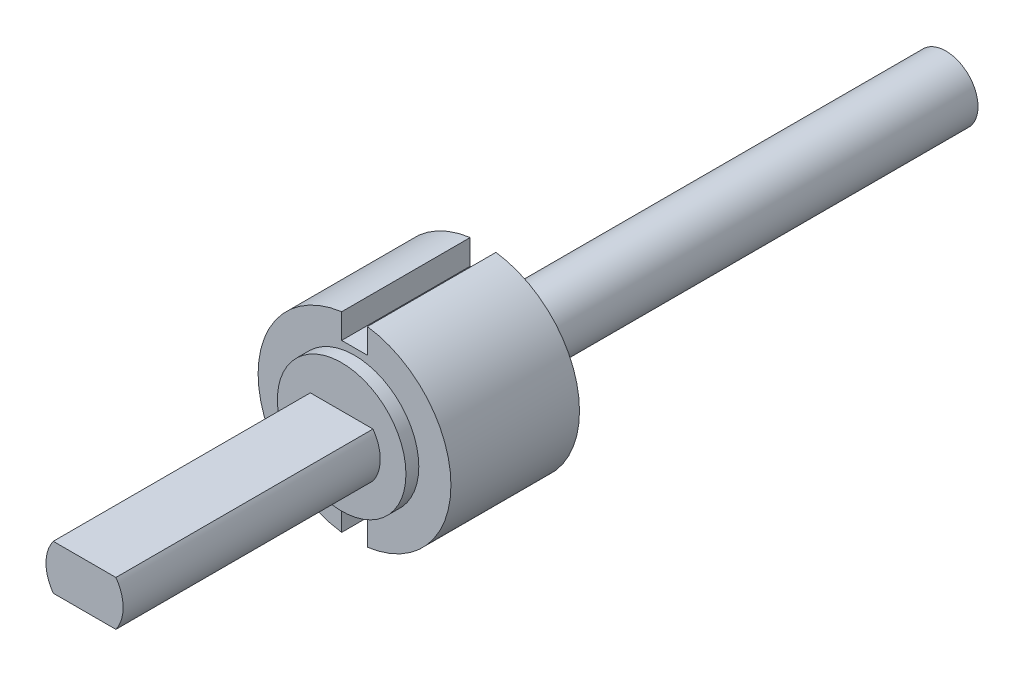
from build123d import *

# Parameters (mm, degrees)
SKETCH_1_R          = 7.5
EXTRUDE_1_DEPTH     = 5
SKETCH_6_R          = 5
EXTRUDE_6_DEPTH     = 1
EXTRUDE_7_DEPTH     = 20
SKETCH_9_R          = 2.5
EXTRUDE_8_DEPTH     = 36
SKETCH_11_W         = 2
SKETCH_11_H         = 2
CUT_EXTRUDE_1_DEPTH = 10


with BuildPart() as part:
    # Эскиз1 → Бобышка-Вытянуть1 (new, symmetric)
    with BuildSketch(Plane.XY):
        Circle(SKETCH_1_R)
    extrude(amount=EXTRUDE_1_DEPTH, both=True)

    # Эскиз6 → Бобышка-Вытянуть6 (add)
    with BuildSketch(Plane.XY.offset(5)):
        Circle(SKETCH_6_R)
    extrude(amount=EXTRUDE_6_DEPTH)

    # Эскиз10 → Бобышка-Вытянуть7 (add)
    with BuildSketch(Plane.XY.offset(6)):
        with BuildLine():
            Line((2.436698586, 1.75), (-2.436698586, 1.75))
            ThreePointArc((-2.436698586, 1.75), (-3, 0), (-2.436698586, -1.75))
            Line((-2.436698586, -1.75), (2.436698586, -1.75))
            ThreePointArc((2.436698586, -1.75), (2.855704445, -0.919212772), (3, 0))
            ThreePointArc((3, 0), (2.855704445, 0.919212772), (2.436698586, 1.75))
        make_face()
    extrude(amount=EXTRUDE_7_DEPTH)

    # Эскиз9 → Бобышка-Вытянуть8 (add)
    with BuildSketch(Plane(origin=(0, 0, -5), x_dir=(-1, 0, 0), z_dir=(0, 0, -1))):
        with Locations(Location((0, 0, 0), (0, 0, 180))):
            Circle(SKETCH_9_R)
    extrude(amount=EXTRUDE_8_DEPTH)

    # Эскиз11 → Вырез-Вытянуть1 (cut)
    with BuildSketch(Plane.XY.offset(5)):
        with Locations((0, 6.5)):
            Rectangle(SKETCH_11_W, SKETCH_11_H)
        with Locations((0, -6.5)):
            Rectangle(SKETCH_11_W, SKETCH_11_H)
    extrude(amount=-CUT_EXTRUDE_1_DEPTH, mode=Mode.SUBTRACT)


solid = part.part
